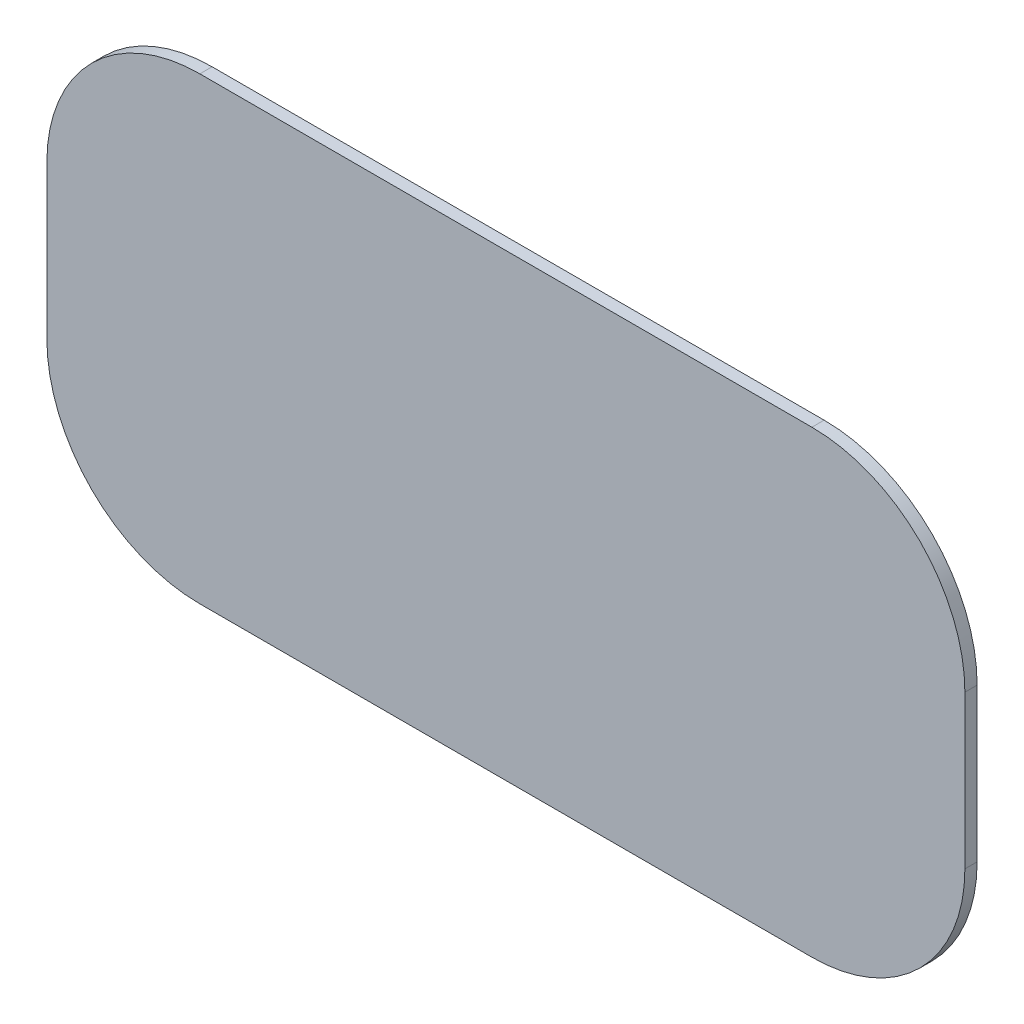
from build123d import *

# Parameters (mm, degrees)
AUFSATZ_LINEAR_AUSTRAGEN1_DEPTH = 0.8


with BuildPart() as part:
    # Skizze1 → Aufsatz-Linear austragen1 (new body)
    with BuildSketch(Plane.XY):
        with BuildLine():
            Line((10, 0), (50, 0))
            ThreePointArc((50, 0), (57.071067812, -2.928932188), (60, -10))
            Line((60, -10), (60, -20))
            ThreePointArc((60, -20), (57.071067812, -27.071067812), (50, -30))
            Line((50, -30), (10, -30))
            ThreePointArc((10, -30), (2.928932188, -27.071067812), (0, -20))
            Line((0, -20), (0, -10))
            ThreePointArc((0, -10), (2.928932188, -2.928932188), (10, 0))
        make_face()
    extrude(amount=AUFSATZ_LINEAR_AUSTRAGEN1_DEPTH)


solid = part.part
